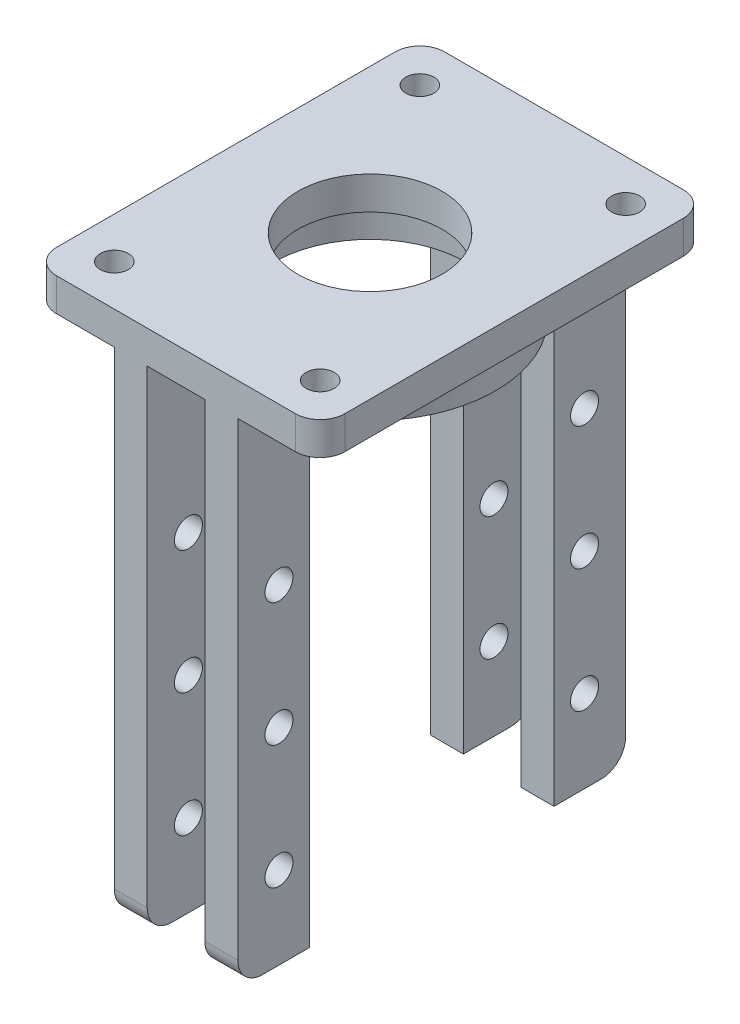
from build123d import *

# Parameters (mm, degrees)
SKETCH1_W           = 35
SKETCH1_H           = 47.11
BOSS_EXTRUDE1_DEPTH = 4
SKETCH2_R           = 15.25
SKETCH2_R_2         = 11.75
BOSS_EXTRUDE2_DEPTH = 5
BOSS_EXTRUDE3_DEPTH = 60
CUT_EXTRUDE1_START  = -55
CUT_EXTRUDE1_DEPTH  = 55
SKETCH6_R           = 1.7
CUT_EXTRUDE2_DEPTH  = 60
SKETCH7_R           = 8.75
CUT_EXTRUDE3_DEPTH  = 60
FILLET2_R           = 3
FILLET3_R           = 3
SKETCH10_R          = 1.7
CUT_EXTRUDE4_DEPTH  = 71.406590778
FILLET4_R           = 3


with BuildPart() as part:
    # Sketch1 → Boss-Extrude1 (new body)
    with BuildSketch(Plane(origin=(0, 0, 0), x_dir=(1, 0, 0), z_dir=(0, 1, 0))):
        Rectangle(SKETCH1_W, SKETCH1_H)
    extrude(amount=BOSS_EXTRUDE1_DEPTH)

    # Sketch2 → Boss-Extrude2 (add)
    with BuildSketch(Plane.XZ):
        with Locations(Location((0, 0, 0), (0, 0, 90))):
            Circle(SKETCH2_R)
        with Locations(Location((0, 0, 0), (0, 0, 270))):
            Circle(SKETCH2_R_2, mode=Mode.SUBTRACT)
    extrude(amount=BOSS_EXTRUDE2_DEPTH)

    # Sketch3 → Boss-Extrude3 (add)
    with BuildSketch(Plane(origin=(0, 0, 0), x_dir=(-1, 0, 0), z_dir=(0, -1, 0))):
        with BuildLine():
            Line((7.5, 23.555), (7.5, 13.278271725))
            ThreePointArc((7.5, 13.278271725), (5.555361105, 14.202128819), (3.5, 14.842927609))
            Line((3.5, 14.842927609), (3.5, 23.555))
            Line((3.5, 23.555), (7.5, 23.555))
        make_face()
        with BuildLine():
            Line((-7.5, 23.555), (-3.5, 23.555))
            Line((-3.5, 23.555), (-3.5, 14.842927609))
            ThreePointArc((-3.5, 14.842927609), (-5.555361105, 14.202128819), (-7.5, 13.278271725))
            Line((-7.5, 13.278271725), (-7.5, 23.555))
        make_face()
        with BuildLine():
            Line((-7.5, -23.555), (-7.5, -13.278271725))
            ThreePointArc((-7.5, -13.278271725), (-5.555361105, -14.202128819), (-3.5, -14.842927609))
            Line((-3.5, -14.842927609), (-3.5, -23.555))
            Line((-3.5, -23.555), (-7.5, -23.555))
        make_face()
        with BuildLine():
            Line((3.5, -23.555), (3.5, -14.842927609))
            ThreePointArc((3.5, -14.842927609), (5.555361105, -14.202128819), (7.5, -13.278271725))
            Line((7.5, -13.278271725), (7.5, -23.555))
            Line((7.5, -23.555), (3.5, -23.555))
        make_face()
    extrude(amount=BOSS_EXTRUDE3_DEPTH)

    # Sketch5 → Cut-Extrude1 (cut)
    with BuildSketch(Plane.XZ.offset(60).offset(CUT_EXTRUDE1_START)):
        with BuildLine():
            ThreePointArc((-7.5, -13.278271725), (-5.555361105, -14.202128819), (-3.5, -14.842927609))
            Line((-3.5, -14.842927609), (-7.5, -14.842927609))
            Line((-7.5, -14.842927609), (-7.5, -13.278271725))
        make_face()
        with BuildLine():
            Line((7.5, 14.842927609), (3.5, 14.842927609))
            ThreePointArc((3.5, 14.842927609), (5.555361105, 14.202128819), (7.5, 13.278271725))
            Line((7.5, 13.278271725), (7.5, 14.842927609))
        make_face()
        with BuildLine():
            ThreePointArc((3.5, -14.842927609), (5.555361105, -14.202128819), (7.5, -13.278271725))
            Line((7.5, -13.278271725), (7.5, -14.842927609))
            Line((7.5, -14.842927609), (3.5, -14.842927609))
        make_face()
        with BuildLine():
            Line((-3.5, 14.842927609), (-7.5, 14.842927609))
            Line((-7.5, 14.842927609), (-7.5, 13.278271725))
            ThreePointArc((-7.5, 13.278271725), (-5.555361105, 14.202128819), (-3.5, 14.842927609))
        make_face()
    extrude(amount=CUT_EXTRUDE1_DEPTH, mode=Mode.SUBTRACT)

    # Sketch6 → Cut-Extrude2 (cut)
    with BuildSketch(Plane(origin=(7.5, 0, 0), x_dir=(0, 0, -1), z_dir=(1, 0, 0))):
        with Locations((-18.555, -35)):
            Circle(SKETCH6_R)
        with Locations((-18.555, -20)):
            Circle(SKETCH6_R)
        with Locations((-18.555, -50)):
            Circle(SKETCH6_R)
        with Locations((18.555, -50)):
            Circle(SKETCH6_R)
        with Locations((18.555, -35)):
            Circle(SKETCH6_R)
        with Locations((18.555, -20)):
            Circle(SKETCH6_R)
    extrude(amount=-CUT_EXTRUDE2_DEPTH, mode=Mode.SUBTRACT)

    # Sketch7 → Cut-Extrude3 (cut)
    with BuildSketch(Plane(origin=(0, 4, 0), x_dir=(1, 0, 0), z_dir=(0, 1, 0))):
        with Locations(Location((0, 0, 0), (0, 0, 270))):
            Circle(SKETCH7_R)
    extrude(amount=-CUT_EXTRUDE3_DEPTH, mode=Mode.SUBTRACT)

    # Fillet2
    fillet2_edges = [part.edges().sort_by_distance(p)[0] for p in [
        (5.5, -5, -14.842927609),
        (-5.5, -5, -14.842927609),
        (-5.5, -5, 14.842927609),
        (5.5, -5, 14.842927609),
    ]]
    fillet(fillet2_edges, radius=FILLET2_R)

    # Fillet3
    fillet3_edges = [part.edges().sort_by_distance(p)[0] for p in [
        (-5.5, -60, -23.555),
        (5.5, -60, -23.555),
        (5.5, -60, 23.555),
        (-5.5, -60, 23.555),
    ]]
    fillet(fillet3_edges, radius=FILLET3_R)

    # Sketch10 → Cut-Extrude4 (cut, through all)
    with BuildSketch(Plane(origin=(0, 4, 0), x_dir=(1, 0, 0), z_dir=(0, 1, 0))):
        with Locations(Location((-12.5, 18.555, 0), (0, 0, 270))):
            Circle(SKETCH10_R)
        with Locations(Location((12.5, 18.555, 0), (0, 0, 270))):
            Circle(SKETCH10_R)
        with Locations(Location((12.5, -18.555, 0), (0, 0, 270))):
            Circle(SKETCH10_R)
        with Locations(Location((-12.5, -18.555, 0), (0, 0, 270))):
            Circle(SKETCH10_R)
    extrude(amount=-CUT_EXTRUDE4_DEPTH, mode=Mode.SUBTRACT)

    # Fillet4
    fillet4_edges = [part.edges().sort_by_distance(p)[0] for p in [
        (-17.5, 2, -23.555),
        (17.5, 2, -23.555),
        (17.5, 2, 23.555),
        (-17.5, 2, 23.555),
    ]]
    fillet(fillet4_edges, radius=FILLET4_R)


solid = part.part
